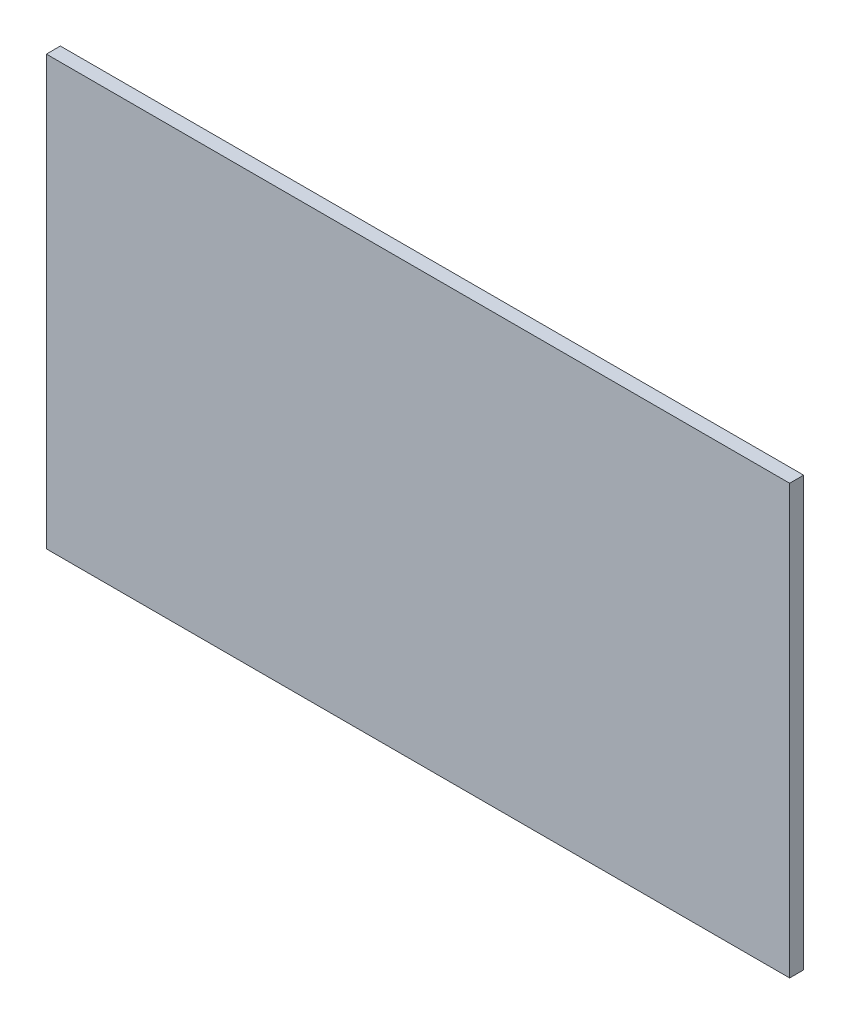
from build123d import *

# Parameters (mm, degrees)
SKETCH_1_W      = 85
SKETCH_1_H      = 49
EXTRUDE_1_DEPTH = 1.6


with BuildPart() as part:
    # ｽｹｯﾁ1 → ﾎﾞｽ - 押し出し1 (new body)
    with BuildSketch(Plane.XY):
        with Locations((-31.394417438, 37.492857143)):
            Rectangle(SKETCH_1_W, SKETCH_1_H)
    extrude(amount=EXTRUDE_1_DEPTH)


solid = part.part
